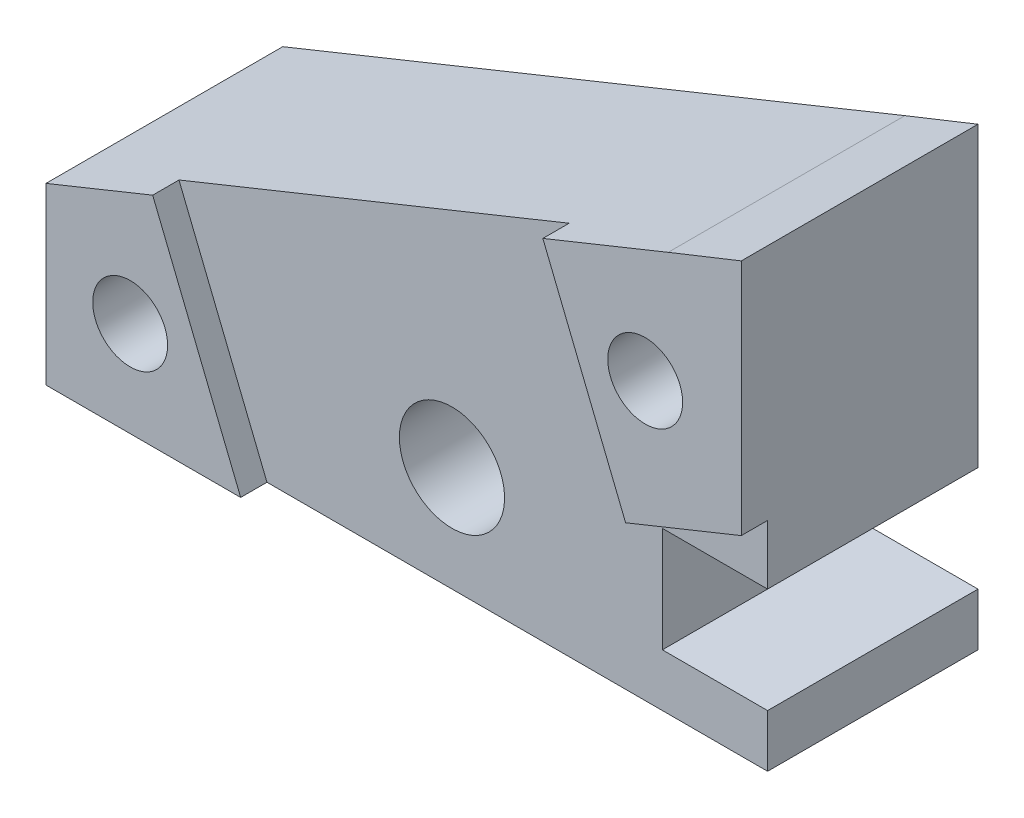
from build123d import *

# Parameters (mm, degrees)
SKETCH1_R           = 1.5875
SKETCH1_R_2         = 1.1303
BOSS_EXTRUDE1_DEPTH = 7.14375
CUT_EXTRUDE2_DEPTH  = 0.79375


with BuildPart() as part:
    # Sketch1 → Boss-Extrude1 (new body)
    with BuildSketch(Plane.XY):
        Polygon((6.35, 1.5875), (9.525, 1.5875), (9.525, 4.224628752), (9.525, 10.562648806), (7.319307862, 9.683908365), (-11.458663934, 2.097115291), (-11.458663934, -3.175), (9.525, -3.175), (9.525, -1.5875), (6.35, -1.5875), align=None)
        Circle(SKETCH1_R, mode=Mode.SUBTRACT)
        with Locations((-8.918663934, -0.301005903)):
            Circle(SKETCH1_R_2, mode=Mode.SUBTRACT)
        with Locations((6.624646204, 5.978899029)):
            Circle(SKETCH1_R_2, mode=Mode.SUBTRACT)
    extrude(amount=BOSS_EXTRUDE1_DEPTH)

    # Sketch3 → Cut-Extrude2 (cut)
    with BuildSketch(Plane.XY.offset(7.14375)):
        Polygon((-8.345148438, 3.659663992), (-5.450582972, -3.504636938), (9.525, -3.219186714), (9.525, 3.382363055), (6.034120938, 1.971956363), (3.430086515, 8.417167728), align=None)
    extrude(amount=-CUT_EXTRUDE2_DEPTH, mode=Mode.SUBTRACT)


solid = part.part
